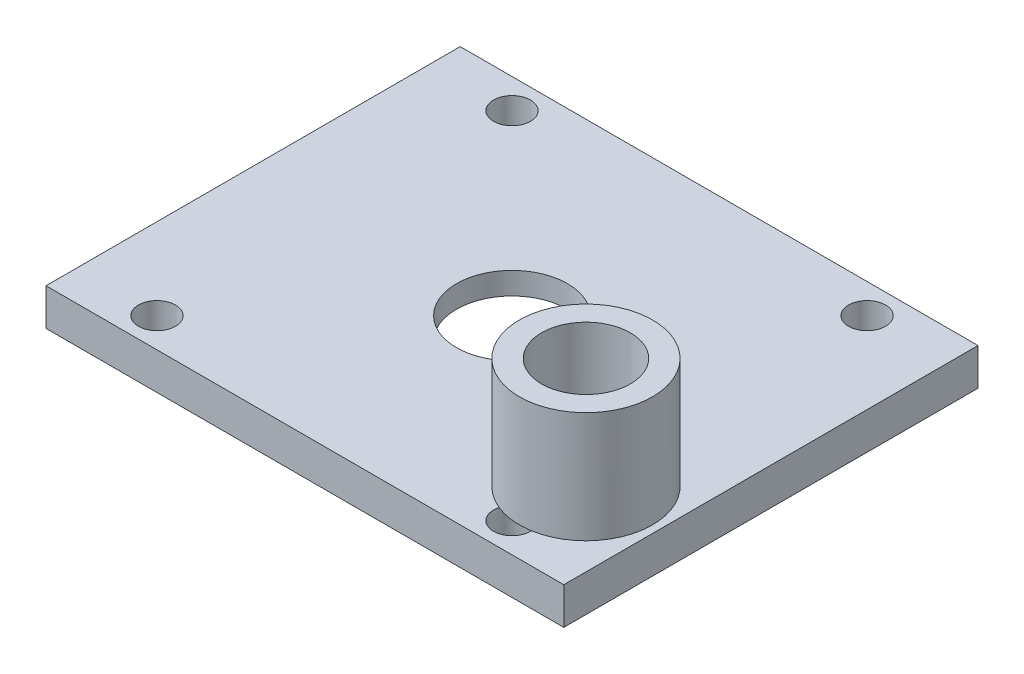
from build123d import *

# Parameters (mm, degrees)
SKETCH1_W               = 70
SKETCH1_H               = 56
BOSS_EXTRUDE1_DEPTH     = 5
SKETCH2_R               = 9
BOSS_EXTRUDE2_DEPTH     = 15
SKETCH4_R               = 19
CUT_EXTRUDE2_DEPTH      = 2
CUT_EXTRUDE3_DEPTH      = 49.301138703
CUT_EXTRUDE3_DEPTH_BACK = 49.301138703
SKETCH5_R               = 7.5
SKETCH6_R               = 6
CUT_EXTRUDE4_DEPTH      = 15
SKETCH7_R               = 2.5
CUT_EXTRUDE5_DEPTH      = 48.265209192


with BuildPart() as part:
    # Sketch1 → Boss-Extrude1 (new body)
    with BuildSketch(Plane(origin=(0, 0, 0), x_dir=(1, 0, 0), z_dir=(0, 1, 0))):
        Rectangle(SKETCH1_W, SKETCH1_H)
    extrude(amount=BOSS_EXTRUDE1_DEPTH)

    # Sketch2 → Boss-Extrude2 (add)
    with BuildSketch(Plane(origin=(0, 5, 0), x_dir=(1, 0, 0), z_dir=(0, 1, 0))):
        with Locations(Location((25, -15, 0), (0, 0, 90))):
            Circle(SKETCH2_R)
    extrude(amount=BOSS_EXTRUDE2_DEPTH)

    # Sketch4 → Cut-Extrude2 (cut)
    with BuildSketch(Plane.XZ):
        with Locations(Location((0, 0, 0), (0, 0, 270))):
            Circle(SKETCH4_R)
    extrude(amount=-CUT_EXTRUDE2_DEPTH, mode=Mode.SUBTRACT)

    # Sketch5 → Cut-Extrude3 (cut, two sides: drawn at the far end of the back side and taken through both)
    with BuildSketch(Plane.XZ.offset(-2).offset(-CUT_EXTRUDE3_DEPTH_BACK)):
        with Locations(Location((0, 0, 0), (0, 0, 270))):
            Circle(SKETCH5_R)
    extrude(amount=CUT_EXTRUDE3_DEPTH + CUT_EXTRUDE3_DEPTH_BACK, mode=Mode.SUBTRACT)

    # Sketch6 → Cut-Extrude4 (cut)
    with BuildSketch(Plane(origin=(0, 20, 0), x_dir=(1, 0, 0), z_dir=(0, 1, 0))):
        with Locations(Location((25, -15, 0), (0, 0, 270))):
            Circle(SKETCH6_R)
    extrude(amount=-CUT_EXTRUDE4_DEPTH, mode=Mode.SUBTRACT)

    # Sketch7 → Cut-Extrude5 (cut, through all)
    with BuildSketch(Plane(origin=(0, 5, 0), x_dir=(1, 0, 0), z_dir=(0, 1, 0))):
        with Locations(Location((-24, 24, 0), (0, 0, 270))):
            Circle(SKETCH7_R)
        with Locations(Location((24, 24, 0), (0, 0, 270))):
            Circle(SKETCH7_R)
        with Locations(Location((24, -24, 0), (0, 0, 270))):
            Circle(SKETCH7_R)
        with Locations(Location((-24, -24, 0), (0, 0, 270))):
            Circle(SKETCH7_R)
    extrude(amount=-CUT_EXTRUDE5_DEPTH, mode=Mode.SUBTRACT)


solid = part.part
